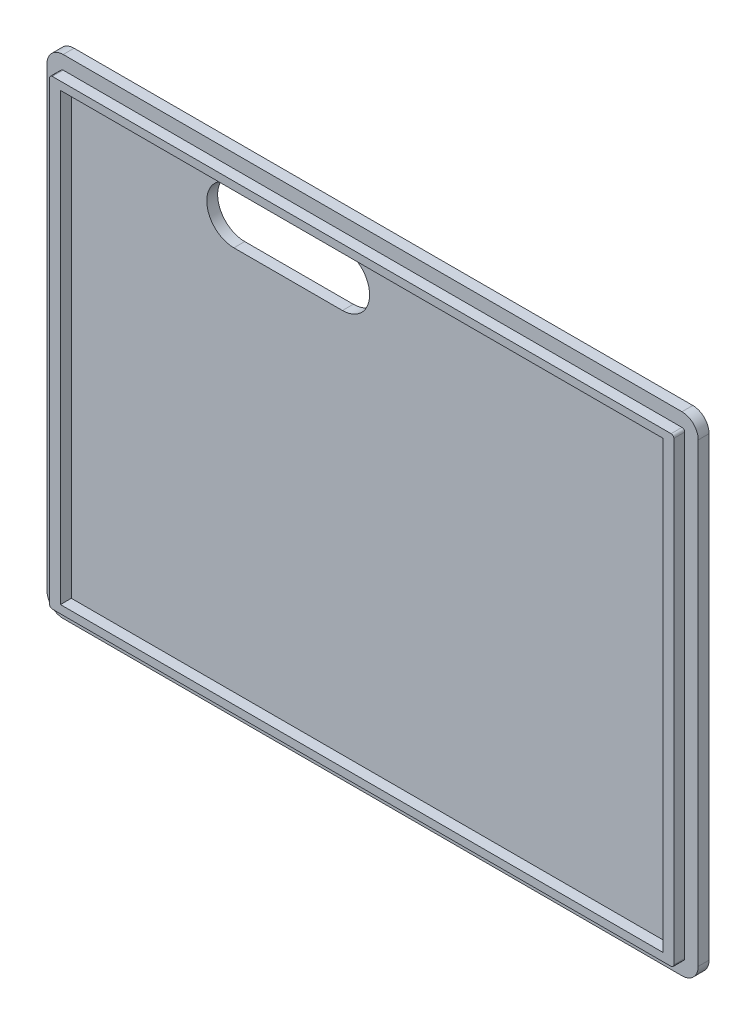
from build123d import *

# Parameters (mm, degrees)
ESQUISSE1_W             = 120
ESQUISSE1_H             = 90
BOSS_EXTRU_1_DEPTH      = 2
ESQUISSE2_W             = 115
ESQUISSE2_H             = 85
ESQUISSE2_W_2           = 111
ESQUISSE2_H_2           = 82.04347826
BOSS_EXTRU_2_DEPTH      = 2
ENL_V_MAT_EXTRU_1_DEPTH = 2
CONG_1_R                = 3
CONG_2_R                = 0.5


with BuildPart() as part:
    # Esquisse1 → Boss.-Extru.1 (new body)
    with BuildSketch(Plane.XY):
        Rectangle(ESQUISSE1_W, ESQUISSE1_H)
    extrude(amount=BOSS_EXTRU_1_DEPTH)

    # Esquisse2 → Boss.-Extru.2 (add)
    with BuildSketch(Plane.XY.offset(2)):
        Rectangle(ESQUISSE2_W, ESQUISSE2_H)
        Rectangle(ESQUISSE2_W_2, ESQUISSE2_H_2, mode=Mode.SUBTRACT)
    extrude(amount=BOSS_EXTRU_2_DEPTH)

    # Esquisse3 → Enlèv. mat.-Extru.1 (cut)
    with BuildSketch(Plane(origin=(0, 0, 0), x_dir=(-1, 0, 0), z_dir=(0, 0, -1))):
        with BuildLine():
            Line((5.548380707, 39.874958244), (25.548380707, 39.874958244))
            ThreePointArc((25.548380707, 39.874958244), (30.548380707, 34.874958244), (25.548380707, 29.874958244))
            Line((25.548380707, 29.874958244), (5.548380707, 29.874958244))
            ThreePointArc((5.548380707, 29.874958244), (0.548380707, 34.874958244), (5.548380707, 39.874958244))
        make_face()
    extrude(amount=-ENL_V_MAT_EXTRU_1_DEPTH, mode=Mode.SUBTRACT)

    # Congé1
    cong_1_edges = [part.edges().sort_by_distance(p)[0] for p in [
        (-60, 45, 1),
        (60, 45, 1),
        (60, -45, 1),
        (-60, -45, 1),
    ]]
    fillet(cong_1_edges, radius=CONG_1_R)

    # Congé2
    cong_2_edges = [part.edges().sort_by_distance(p)[0] for p in [
        (-57.5, 42.5, 3),
        (-57.5, -42.5, 3),
        (57.5, -42.5, 3),
        (57.5, 42.5, 3),
    ]]
    fillet(cong_2_edges, radius=CONG_2_R)


solid = part.part
